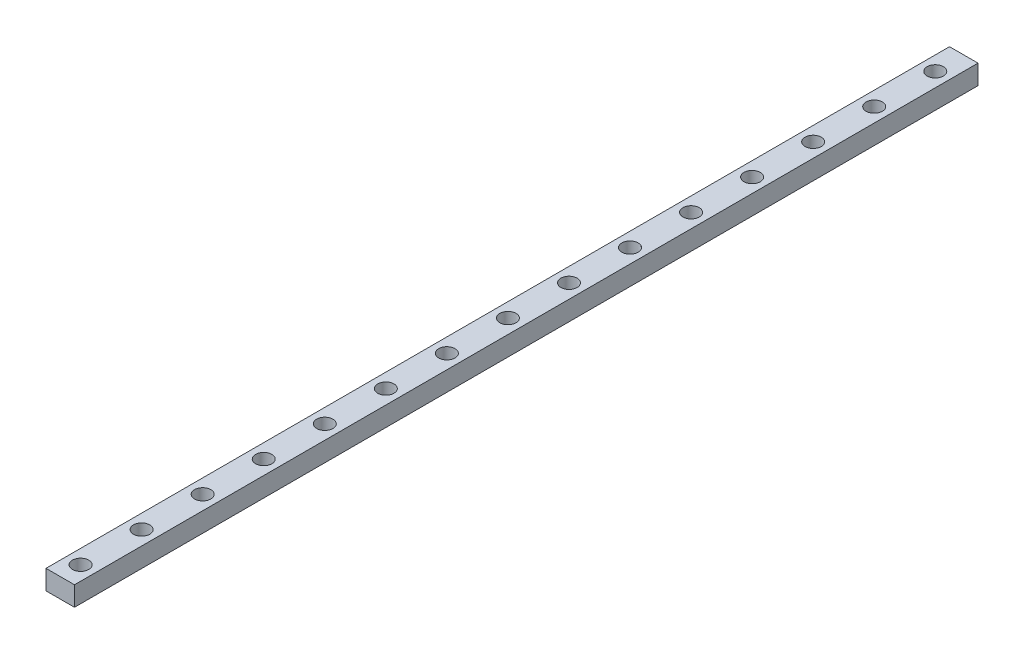
from build123d import *

# Parameters (mm, degrees)
SKETCH_1_W             = 7
SKETCH_1_H             = 4.8
EXTRUDE_1_DEPTH        = 280
SKETCH_2_R             = 2
CUT_EXTRUDE_1_DEPTH    = 3
PATTERN_LINEAR_1_COUNT = 19
PATTERN_LINEAR_1_PITCH = 15
SKETCH_3_R             = 1
CUT_EXTRUDE_2_DEPTH    = 3
PATTERN_LINEAR_2_COUNT = 19
PATTERN_LINEAR_2_PITCH = 15
SKETCH_4_W             = 7
SKETCH_4_H             = 58
CUT_EXTRUDE_3_DEPTH    = 10


with BuildPart() as part:
    # 草图1 → 凸台-拉伸1 (new body)
    with BuildSketch(Plane.XY):
        with Locations((3.5, -2.4)):
            Rectangle(SKETCH_1_W, SKETCH_1_H)
    extrude(amount=EXTRUDE_1_DEPTH)

    # 草图2 → 切除-拉伸1 (cut)
    with BuildSketch(Plane(origin=(0, 0, 0), x_dir=(1, 0, 0), z_dir=(0, 1, 0))):
        with Locations(Location((3.5, -5, 0), (0, 0, 270))):
            Circle(SKETCH_2_R)
    cut_extrude_1 = extrude(amount=-CUT_EXTRUDE_1_DEPTH, mode=Mode.SUBTRACT)

    # 阵列(线性)1: 切除-拉伸1 ×19
    with Locations(*[(0, 0, i * PATTERN_LINEAR_1_PITCH) for i in range(1, PATTERN_LINEAR_1_COUNT)]):
        add(cut_extrude_1, mode=Mode.SUBTRACT)

    # 草图3 → 切除-拉伸2 (cut)
    with BuildSketch(Plane(origin=(0, -4.8, 0), x_dir=(-1, 0, 0), z_dir=(0, -1, 0))):
        with Locations(Location((-3.5, -5, 0), (0, 0, 90))):
            Circle(SKETCH_3_R)
    cut_extrude_2 = extrude(amount=-CUT_EXTRUDE_2_DEPTH, mode=Mode.SUBTRACT)

    # 阵列(线性)2: 切除-拉伸2 ×19
    with Locations(*[(0, 0, i * PATTERN_LINEAR_2_PITCH) for i in range(1, PATTERN_LINEAR_2_COUNT)]):
        add(cut_extrude_2, mode=Mode.SUBTRACT)

    # 草图4 → 切除-拉伸3 (cut)
    with BuildSketch(Plane(origin=(0, 0, 0), x_dir=(1, 0, 0), z_dir=(0, 1, 0))):
        with Locations((3.5, -29)):
            Rectangle(SKETCH_4_W, SKETCH_4_H)
    extrude(amount=-CUT_EXTRUDE_3_DEPTH, mode=Mode.SUBTRACT)


solid = part.part
